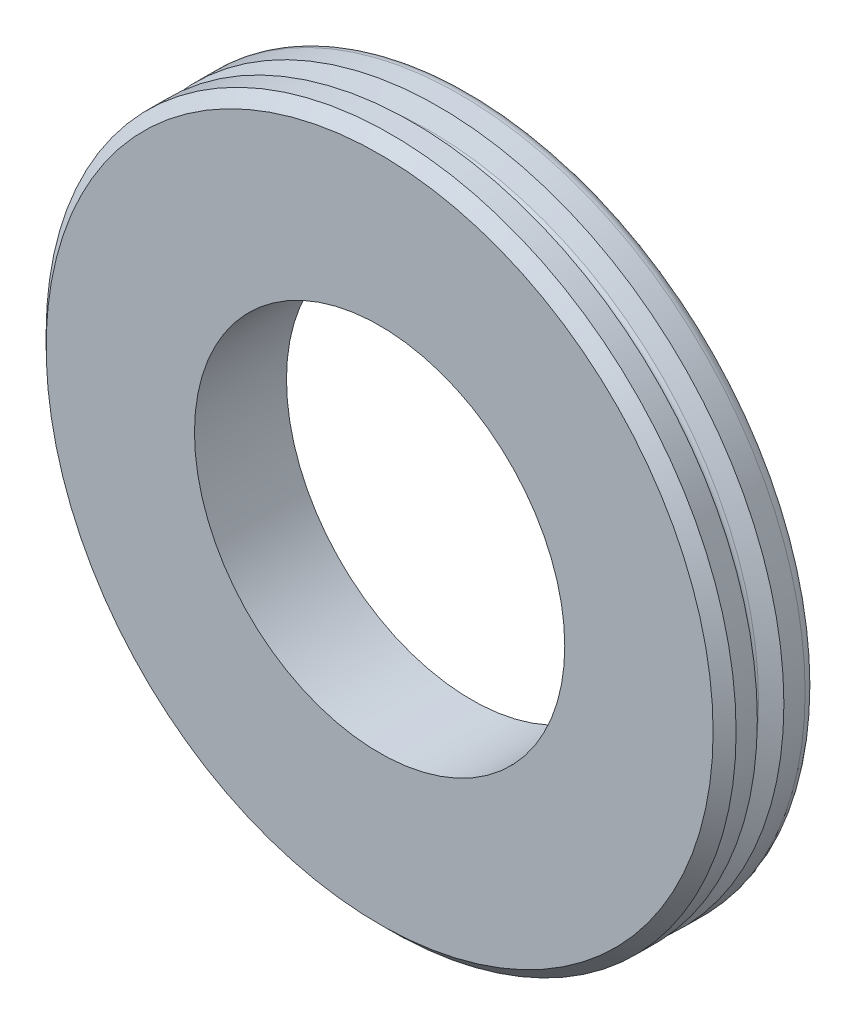
from build123d import *

# Parameters (mm, degrees)
SKETCH_1_R      = 15
SKETCH_1_R_2    = 8.05
EXTRUDE_2_DEPTH = 2
FILLET_1_R      = 0.2
CHAMFER_1_SIZE  = 0.5
FILLET_2_R      = 0.5


with BuildPart() as part:
    # Эскиз1 → Бобышка-Вытянуть2 (new, symmetric)
    with BuildSketch(Plane.XY):
        Circle(SKETCH_1_R)
        Circle(SKETCH_1_R_2, mode=Mode.SUBTRACT)
    extrude(amount=EXTRUDE_2_DEPTH, both=True)

    # Эскиз2 → Вырез-Повернуть1 (revolve, cut)
    with BuildSketch(Plane(origin=(0, 0, 0), x_dir=(0, 0, -1), z_dir=(1, 0, 0)), mode=Mode.PRIVATE) as cut_revolve_1_sk:
        Polygon((-0.577350269, 15), (0.577350269, 15), (0, 14), align=None)
    revolve(cut_revolve_1_sk.sketch.rotate(Axis((0, 0, 3.24866267), (0, 0, -1)), 90), axis=Axis((0, 0, 3.24866267), (0, 0, -1)), mode=Mode.SUBTRACT)

    # Скругление1
    fillet_1_edges = [part.edges().sort_by_distance(p)[0] for p in [
        (-14, 0, 0),
    ]]
    fillet(fillet_1_edges, radius=FILLET_1_R)

    # Фаска1
    chamfer_1_edges = [part.edges().sort_by_distance(p)[0] for p in [
        (-15, 0, 2),
    ]]
    chamfer(chamfer_1_edges, length=CHAMFER_1_SIZE)

    # Скругление2
    fillet_2_edges = [part.edges().sort_by_distance(p)[0] for p in [
        (-15, 0, -2),
    ]]
    fillet(fillet_2_edges, radius=FILLET_2_R)


solid = part.part
